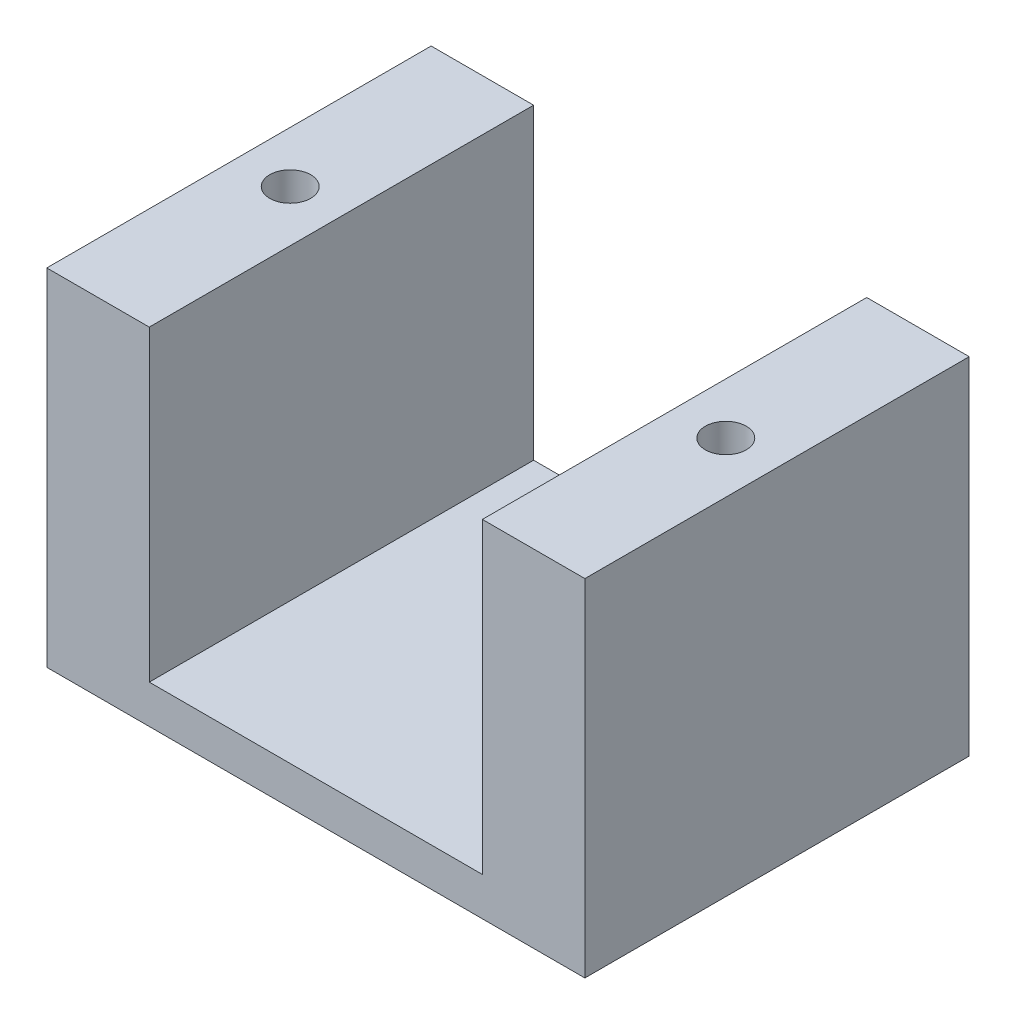
from build123d import *

# Parameters (mm, degrees)
SALIENTE_EXTRUIR1_DEPTH    = 30
CORTAR_EXTRUIR1_DEPTH      = 15
CORTAR_EXTRUIR1_DEPTH_BACK = 41
CROQUIS2_R                 = 1.6
CROQUIS3_R                 = 2.9
CORTAR_EXTRUIR2_DEPTH      = 3.2
SKETCH1_R                  = 0.661549992
CUT_EXTRUDE1_DEPTH         = 0.4


with BuildPart() as part:
    # Croquis1 → Saliente-Extruir1 (new body)
    with BuildSketch(Plane.XY):
        Polygon((-21, 0), (-21, 27), (-13, 27), (-13, 3), (13, 3), (13, 27), (21, 27), (21, 0), align=None)
    extrude(amount=SALIENTE_EXTRUIR1_DEPTH)

    # Croquis2 → Cortar-Extruir1 (cut, two sides: drawn at the far end of the back side and taken through both)
    with BuildSketch(Plane.XZ.offset(-CORTAR_EXTRUIR1_DEPTH_BACK)):
        with Locations(Location((-17, 15, 0), (0, 0, 90))):
            Circle(CROQUIS2_R)
        with Locations(Location((17, 15, 0), (0, 0, 90))):
            Circle(CROQUIS2_R)
    extrude(amount=CORTAR_EXTRUIR1_DEPTH + CORTAR_EXTRUIR1_DEPTH_BACK, mode=Mode.SUBTRACT)

    # Croquis3 → Cortar-Extruir2 (cut)
    with BuildSketch(Plane.XZ):
        with Locations(Location((-17, 15, 0), (0, 0, 270))):
            Circle(CROQUIS3_R)
        with Locations(Location((17, 15, 0), (0, 0, 90))):
            Circle(CROQUIS3_R)
    extrude(amount=-CORTAR_EXTRUIR2_DEPTH, mode=Mode.SUBTRACT)

    # Sketch1 → Cut-Extrude1 (cut)
    # profile 1 of 7: a face of its own
    with BuildSketch(Plane.XZ):
        with BuildLine():
            Line((-5.935999793, 6.438605572), (9.678181575, 6.438605572))
            add(Edge.make_bspline(
                [(9.678181575, 6.438605572), (10.524299676, 6.453092153), (10.536716692, 7.227891763)],
                knots=[0, 0, 0, 1, 1, 1], degree=2))
            Line((10.536716692, 7.227891763), (10.536716692, 20.957100846))
            add(Edge.make_bspline(
                [(9.678181575, 22.106217079), (10.162482833, 22.073196538), (10.536716692, 21.695427507), (10.536716692, 20.957100846)],
                knots=[0, 0, 0, 0, 1, 1, 1, 1], degree=3))
            Line((9.678181575, 22.106217079), (9.004561714, 22.106217079))
            add(Edge.make_bspline(
                [(8.312539005, 20.630919436), (8.286013306, 22.128234394), (8.338307263, 22.106217079), (9.004561714, 22.106217079)],
                knots=[0, 0, 0, 0, 1, 1, 1, 1], degree=3))
            add(Edge.make_bspline(
                [(8.867643901, 19.868961385), (8.878593238, 20.486835473), (8.312539005, 20.630919436)],
                knots=[0, 0, 0, 1, 1, 1], degree=2))
            Line((8.867643901, 19.868961385), (8.867643901, 9.082596351))
            add(Edge.make_bspline(
                [(7.931444331, 8.073576195), (8.599546043, 8.102198014), (8.867643901, 8.329896708), (8.867643901, 9.082596351)],
                knots=[0, 0, 0, 0, 1, 1, 1, 1], degree=3))
            Line((7.931444331, 8.073576195), (-4.462187712, 8.073576195))
            add(Edge.make_bspline(
                [(-5.467904846, 9.082596351), (-5.433709159, 8.449976132), (-5.30844888, 8.073576195), (-4.462187712, 8.073576195)],
                knots=[0, 0, 0, 0, 1, 1, 1, 1], degree=3))
            Line((-5.467904846, 9.082596351), (-5.467904846, 16.225240488))
            add(Edge.make_bspline(
                [(-6.227323907, 16.964134709), (-5.679994854, 16.964134709), (-5.467904846, 16.719544079), (-5.467904846, 16.225240488)],
                knots=[0, 0, 0, 0, 1, 1, 1, 1], degree=3))
            add(Edge.make_bspline(
                [(-7.060451344, 16.225240488), (-7.033250732, 16.738079235), (-6.945687764, 17.041102265), (-6.227323907, 16.964134709)],
                knots=[0, 0, 0, 0, 1, 1, 1, 1], degree=3))
            Line((-7.060451344, 16.225240488), (-7.060451344, 7.629208643))
            add(Edge.make_bspline(
                [(-5.935999793, 6.438605572), (-6.811453061, 6.382227451), (-7.096596098, 6.700746565), (-7.060451344, 7.629208643)],
                knots=[0, 0, 0, 0, 1, 1, 1, 1], degree=3))
        make_face()
    # profile 2 of 7: a face of its own
    with BuildSketch(Plane.XZ):
        with BuildLine():
            Line((-1.522038325, 11.057965372), (-3.304487637, 9.883355918))
            Line((-3.304487637, 9.883355918), (-3.95725526, 10.532266036))
            Line((-3.95725526, 10.532266036), (-2.69664778, 12.281859139))
            add(Edge.make_bspline(
                [(-2.69664778, 12.281859139), (-2.296419712, 12.30894865), (-1.901088431, 12.60910176)],
                knots=[0, 0, 0, 1, 1, 1], degree=2))
            Line((-1.901088431, 12.60910176), (-0.072061062, 14.43812913))
            Line((-0.072061062, 14.43812913), (0.678700134, 13.69714151))
            Line((0.678700134, 13.69714151), (-1.199414528, 11.794254647))
            add(Edge.make_bspline(
                [(-1.522038325, 11.057965372), (-1.526686537, 11.364992788), (-1.400661149, 11.590353596), (-1.199414528, 11.794254647)],
                knots=[0, 0, 0, 0, 1, 1, 1, 1], degree=3))
        make_face()
    # profile 3 of 7: a face of its own
    with BuildSketch(Plane.XZ):
        with BuildLine():
            Line((-0.354442309, 15.390176677), (5.412555572, 9.698254849))
            add(Edge.make_bspline(
                [(5.412555572, 9.698254849), (5.928798687, 9.302057302), (6.700610258, 9.391128714), (7.125727085, 9.883355918)],
                knots=[0, 0, 0, 0, 1, 1, 1, 1], degree=3))
            add(Edge.make_bspline(
                [(7.125727085, 9.883355918), (7.934302129, 10.799871296), (6.977240411, 11.794254647)],
                knots=[0, 0, 0, 1, 1, 1], degree=2))
            Line((6.977240411, 11.794254647), (1.303415875, 17.468079182))
            add(Edge.make_bspline(
                [(1.303415875, 17.468079182), (1.911666945, 20.540477103), (-1.10270103, 21.574939106), (-2.42824136, 20.752545127)],
                knots=[0, 0, 0, 0, 1, 1, 1, 1], degree=3))
            Line((-2.42824136, 20.752545127), (-0.694584651, 19.041457544))
            Line((-0.694584651, 19.041457544), (-1.366070433, 17.845234527))
            Line((-1.366070433, 17.845234527), (-2.405054872, 17.553329375))
            Line((-2.405054872, 17.553329375), (-4.123067785, 19.248976817))
            add(Edge.make_bspline(
                [(-0.354442309, 15.390176677), (-3.400230967, 14.629724328), (-5.142448484, 17.119603802), (-4.123067785, 19.248976817)],
                knots=[0, 0, 0, 0, 1, 1, 1, 1], degree=3))
        make_face()
        with Locations(Location((6.13875523, 10.776625251, 0), (0, 0, 270))):
            Circle(SKETCH1_R, mode=Mode.SUBTRACT)
    # profile 4 of 7: a face of its own
    with BuildSketch(Plane.XZ):
        with BuildLine():
            Line((3.89207141, 15.458279189), (1.891941088, 17.586897539))
            Line((1.891941088, 17.586897539), (5.230965028, 20.957100846))
            add(Edge.make_bspline(
                [(5.230965028, 20.957100846), (5.555451632, 21.309870343), (6.660184694, 21.36409952), (7.269640603, 20.523170445)],
                knots=[0, 0, 0, 0, 1, 1, 1, 1], degree=3))
            add(Edge.make_bspline(
                [(7.242774573, 18.701199897), (8.073193496, 19.568863686), (7.269640603, 20.523170445)],
                knots=[0, 0, 0, 1, 1, 1], degree=2))
            Line((7.242774573, 18.701199897), (3.89207141, 15.458279189))
        make_face()
        Polygon((3.839024866, 17.163144155), (4.259148948, 16.746906842), (6.762194587, 19.273325593), (6.342070505, 19.689562906), align=None, mode=Mode.SUBTRACT)
        Polygon((3.102284891, 17.893068195), (3.522408973, 17.476830882), (6.025454613, 20.003249633), (5.60533053, 20.419486946), align=None, mode=Mode.SUBTRACT)
    # profile 5 of 7: a face of its own
    with BuildSketch(Plane.XZ):
        with BuildLine():
            add(Edge.make_bspline(
                [(-7.099579962, 18.308936967), (-6.944184766, 19.799579775), (-5.756766751, 20.990125682), (-4.011121589, 21.166157127)],
                knots=[0, 0, 0, 0, 1, 1, 1, 1], degree=3))
            add(Edge.make_bspline(
                [(-4.011121589, 21.166157127), (-3.833143245, 21.190875028), (-3.641894385, 21.375340953), (-3.624888541, 21.60783322)],
                knots=[0, 0, 0, 0, 1, 1, 1, 1], degree=3))
            add(Edge.make_bspline(
                [(-3.624888541, 21.60783322), (-3.639467746, 21.893086016), (-3.884725351, 22.173601101), (-4.195925218, 22.143963019)],
                knots=[0, 0, 0, 0, 1, 1, 1, 1], degree=3))
            add(Edge.make_bspline(
                [(-8.06346903, 18.701199897), (-7.725118315, 20.514418332), (-5.974799785, 22.083491135), (-4.195925218, 22.143963019)],
                knots=[0, 0, 0, 0, 1, 1, 1, 1], degree=3))
            add(Edge.make_bspline(
                [(-7.614023361, 17.927066284), (-8.122682955, 17.975749279), (-8.06346903, 18.701199897)],
                knots=[0, 0, 0, 1, 1, 1], degree=2))
            add(Edge.make_bspline(
                [(-7.099579962, 18.308936967), (-7.183532259, 17.914926879), (-7.614023361, 17.927066284)],
                knots=[0, 0, 0, 1, 1, 1], degree=2))
        make_face()
    # profile 6 of 7: a face of its own
    with BuildSketch(Plane.XZ):
        with BuildLine():
            add(Edge.make_bspline(
                [(-9.319053754, 18.411393731), (-9.333101087, 19.560108027), (-7.895947649, 23.219067723), (-3.95725526, 23.325518869)],
                knots=[0, 0, 0, 0, 1, 1, 1, 1], degree=3))
            add(Edge.make_bspline(
                [(-3.95725526, 23.325518869), (-3.779276916, 23.35023677), (-3.597859082, 23.595665467), (-3.624888541, 23.776531501)],
                knots=[0, 0, 0, 0, 1, 1, 1, 1], degree=3))
            add(Edge.make_bspline(
                [(-3.624888541, 23.776531501), (-3.639467746, 24.061784297), (-3.884725351, 24.317135086), (-4.195925218, 24.287497003)],
                knots=[0, 0, 0, 0, 1, 1, 1, 1], degree=3))
            add(Edge.make_bspline(
                [(-10.243657996, 18.701199897), (-10.182828773, 20.346306567), (-8.409956491, 24.044181671), (-4.195925218, 24.287497003)],
                knots=[0, 0, 0, 0, 1, 1, 1, 1], degree=3))
            add(Edge.make_bspline(
                [(-9.805687565, 17.927066284), (-10.31434716, 17.975749279), (-10.243657996, 18.701199897)],
                knots=[0, 0, 0, 1, 1, 1], degree=2))
            add(Edge.make_bspline(
                [(-9.319053754, 18.411393731), (-9.375196464, 17.914926879), (-9.805687565, 17.927066284)],
                knots=[0, 0, 0, 1, 1, 1], degree=2))
        make_face()
    # profile 7 of 7: a face of its own
    with BuildSketch(Plane.XZ):
        with BuildLine():
            add(Edge.make_bspline(
                [(-11.523144368, 18.395379414), (-11.040898376, 22.612315512), (-7.900523453, 25.441163991), (-3.961831064, 25.547615136)],
                knots=[0, 0, 0, 0, 1, 1, 1, 1], degree=3))
            add(Edge.make_bspline(
                [(-3.961831064, 25.547615136), (-3.783852719, 25.572333037), (-3.602434885, 25.817761734), (-3.629464345, 25.998627769)],
                knots=[0, 0, 0, 0, 1, 1, 1, 1], degree=3))
            add(Edge.make_bspline(
                [(-3.629464345, 25.998627769), (-3.644043549, 26.283880564), (-3.889301155, 26.539231353), (-4.200501022, 26.50959327)],
                knots=[0, 0, 0, 0, 1, 1, 1, 1], degree=3))
            add(Edge.make_bspline(
                [(-12.44774861, 18.68518558), (-12.386919387, 20.33029225), (-10.637820975, 26.082784436), (-4.200501022, 26.50959327)],
                knots=[0, 0, 0, 0, 1, 1, 1, 1], degree=3))
            add(Edge.make_bspline(
                [(-12.00977818, 17.911051966), (-12.518437774, 17.959734961), (-12.44774861, 18.68518558)],
                knots=[0, 0, 0, 1, 1, 1], degree=2))
            add(Edge.make_bspline(
                [(-11.523144368, 18.395379414), (-11.579287078, 17.898912561), (-12.00977818, 17.911051966)],
                knots=[0, 0, 0, 1, 1, 1], degree=2))
        make_face()
    extrude(amount=-CUT_EXTRUDE1_DEPTH, mode=Mode.SUBTRACT)


solid = part.part
